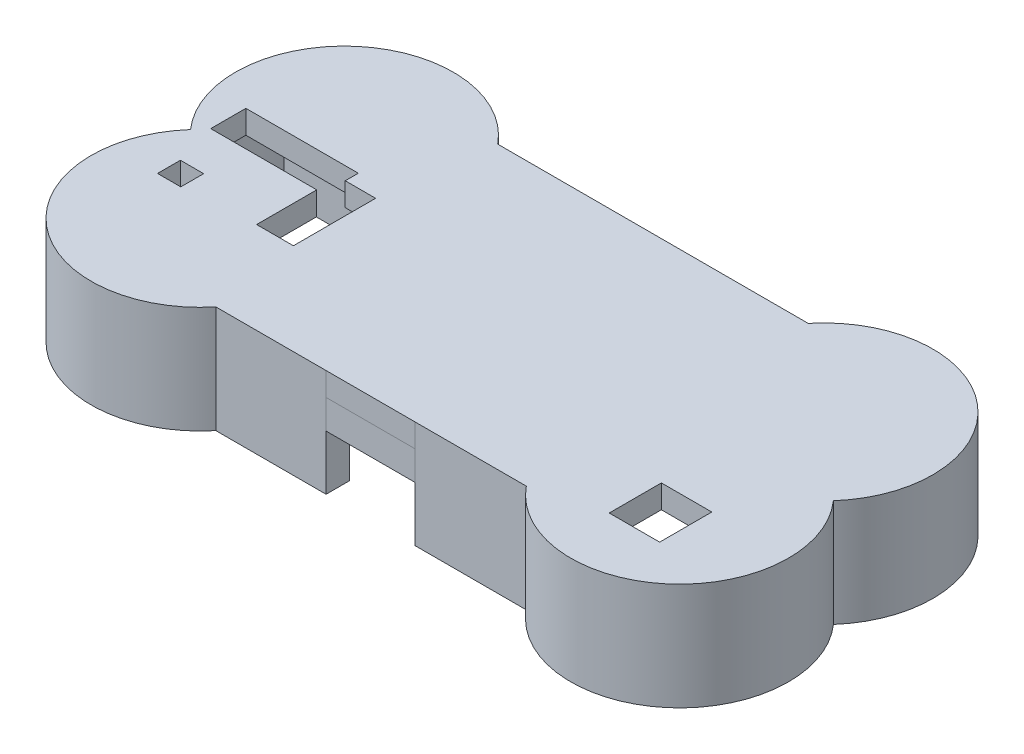
from build123d import *

# Parameters (mm, degrees)
BOSS_EXTRUDE1_DEPTH = 9.144
BOSS_EXTRUDE7_START = 2.54
SKETCH3_W           = 5.497965662
SKETCH3_H           = 5.686621346
SKETCH3_W_2         = 2.537497481
SKETCH3_H_2         = 2.494515015
BOSS_EXTRUDE7_DEPTH = 2.54
BOSS_EXTRUDE8_DEPTH = 9.144
SKETCH9_W           = 9.68799942
SKETCH9_H           = 2.539743385
BOSS_EXTRUDE9_DEPTH = 3.175


with BuildPart() as part:
    # Sketch2 → Boss-Extrude1 (new body)
    with BuildSketch(Plane(origin=(0, 0, 0), x_dir=(1, 0, 0), z_dir=(0, 1, 0))):
        with BuildLine():
            Line((-16.484821535, 14.991226562), (19.965175413, 14.992229827))
            ThreePointArc((19.965175413, 14.992229827), (34.453763808, 16.669641544), (32.919177794, 2.165230163))
            ThreePointArc((32.919177794, 2.165230163), (34.454264788, -12.338688941), (19.966174864, -10.660770051))
            Line((19.966174864, -10.660770051), (6.526477702, -10.661139971))
            Line((6.526477702, -10.661139971), (6.526477702, -13.201139972))
            Line((6.526477702, -13.201139972), (18.666916826, -13.200805813))
            ThreePointArc((18.666916826, -13.200805813), (35.566435216, -14.762300874), (36.785563248, 2.165360379))
            ThreePointArc((36.785563248, 2.165360379), (35.565859505, 19.093319416), (18.665967138, 17.532194068))
            Line((18.665967138, 17.532194068), (-15.185563688, 17.531262324))
            ThreePointArc((-15.185563688, 17.531262324), (-32.085077033, 19.092756448), (-33.30420747, 2.165100491))
            ThreePointArc((-33.30420747, 2.165100491), (-32.08450617, -14.762857534), (-15.184614497, -13.201737557))
            Line((-15.184614497, -13.201737557), (-3.161521718, -13.201406628))
            Line((-3.161521718, -13.201406628), (-3.161521718, -10.661406627))
            Line((-3.161521718, -10.661406627), (-16.483822084, -10.661773316))
            ThreePointArc((-16.483822084, -10.661773316), (-30.972409917, -12.339179924), (-29.437822557, 2.165230163))
            ThreePointArc((-29.437822557, 2.165230163), (-29.581379954, 2.259029678), (-29.723191237, 2.355448738))
            ThreePointArc((-29.723191237, 2.355448738), (-30.849950106, 16.788680298), (-16.484821535, 14.991226562))
        make_face()
    extrude(amount=-BOSS_EXTRUDE1_DEPTH)

    # Sketch3 → Boss-Extrude7 (add)
    with BuildSketch(Plane(origin=(0, 0, 0), x_dir=(-1, 0, 0), z_dir=(0, 1, 0)).offset(BOSS_EXTRUDE7_START)):
        with BuildLine():
            Line((-6.526477702, 13.201139972), (-18.666916826, 13.200805813))
            ThreePointArc((-18.666916826, 13.200805813), (-35.566435216, 14.762300874), (-36.785563248, -2.165360379))
            ThreePointArc((-36.785563248, -2.165360379), (-35.565859505, -19.093319416), (-18.665967138, -17.532194068))
            Line((-18.665967138, -17.532194068), (15.185563688, -17.531262324))
            ThreePointArc((15.185563688, -17.531262324), (32.085077033, -19.092756448), (33.30420747, -2.165100491))
            ThreePointArc((33.30420747, -2.165100491), (32.08450617, 14.762857534), (15.184614497, 13.201737557))
            Line((15.184614497, 13.201737557), (3.161521718, 13.201406628))
            Line((3.161521718, 13.201406628), (-6.526477702, 13.201406628))
            Line((-6.526477702, 13.201406628), (-6.526477702, 13.201139972))
        make_face()
        Polygon((16.725192045, 3.202079604), (20.733260983, 3.202079604), (20.733260983, -3.35074569), (32.292495251, -3.35074569), (32.292495251, -7.184972831), (20.037093812, -7.184972831), (20.037093812, -5.761606936), (16.725192045, -5.761606936), align=None, mode=Mode.SUBTRACT)
        with Locations((-28.472988633, 8.375990138)):
            Rectangle(SKETCH3_W, SKETCH3_H, mode=Mode.SUBTRACT)
        with Locations((29.691821719, 2.533771638)):
            Rectangle(SKETCH3_W_2, SKETCH3_H_2, mode=Mode.SUBTRACT)
    extrude(amount=-BOSS_EXTRUDE7_DEPTH)

    # Sketch8 → Boss-Extrude8 (add)
    with BuildSketch(Plane.XZ):
        with BuildLine():
            Line((-16.484821535, -14.991226562), (19.965175413, -14.992229827))
            Line((19.965175413, -14.992229827), (19.965175413, -12.452229827))
            Line((19.965175413, -12.452229827), (-33.422355561, -12.452229827))
            ThreePointArc((-33.422355561, -12.452229827), (-25.785203294, -19.26939309), (-16.484821535, -14.991226562))
        make_face()
        with BuildLine():
            Line((19.965175413, -12.452229827), (19.965175413, -14.992229827))
            ThreePointArc((19.965175413, -14.992229827), (29.266220586, -19.269979209), (36.903423899, -12.452229827))
            Line((36.903423899, -12.452229827), (26.676938614, -12.452229827))
            Line((26.676938614, -12.452229827), (19.965175413, -12.452229827))
        make_face()
        with BuildLine():
            Line((26.676938614, -12.452229827), (36.903423899, -12.452229827))
            ThreePointArc((36.903423899, -12.452229827), (36.591930347, -6.6578073), (32.919177794, -2.165230163))
            Line((32.919177794, -2.165230163), (26.676938614, -2.165230163))
            Line((26.676938614, -2.165230163), (26.676938614, -12.452229827))
        make_face()
        Polygon((19.966174864, 8.137271719), (19.966174864, 10.660770051), (7.41756795, 10.661115444), (7.41756795, 8.137271719), align=None)
    extrude(amount=BOSS_EXTRUDE8_DEPTH)

    # Sketch9 → Boss-Extrude9 (add)
    with BuildSketch(Plane.XZ):
        with Locations((1.682477992, 11.93127832)):
            Rectangle(SKETCH9_W, SKETCH9_H)
    extrude(amount=BOSS_EXTRUDE9_DEPTH)


solid = part.part
